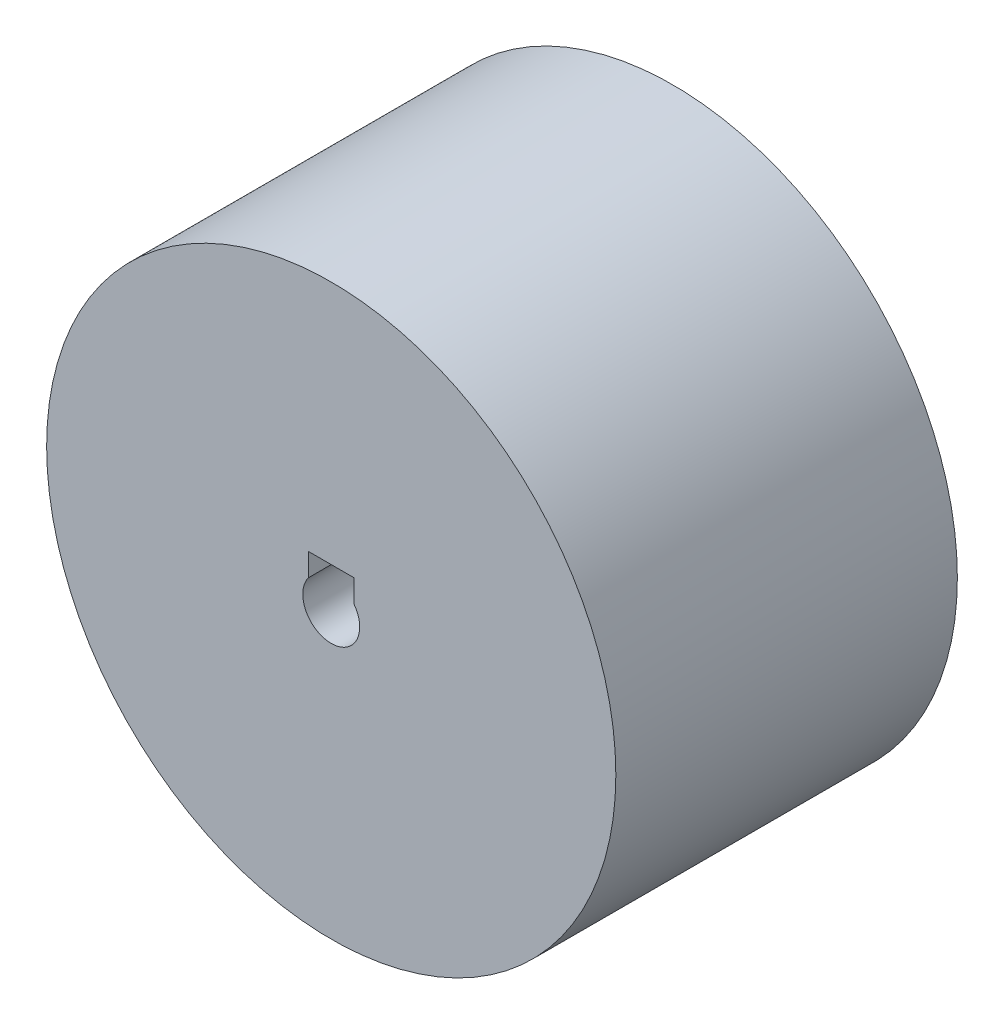
from build123d import *

# Parameters (mm, degrees)
ESQUISSE1_R             = 25
BOSS_EXTRU_1_DEPTH      = 30
ESQUISSE14_R            = 2.5
ENL_V_MAT_EXTRU_1_DEPTH = 47.368092477
ESQUISSE15_W            = 4
ESQUISSE15_H            = 2
ENL_V_MAT_EXTRU_2_DEPTH = 47.368092477


with BuildPart() as part:
    # Esquisse1 → Boss.-Extru.1 (new body)
    with BuildSketch(Plane.XY):
        Circle(ESQUISSE1_R)
    extrude(amount=BOSS_EXTRU_1_DEPTH)

    # Esquisse14 → Enlèv. mat.-Extru.1 (cut, through all)
    with BuildSketch(Plane(origin=(0, 0, 0), x_dir=(-1, 0, 0), z_dir=(0, 0, -1))):
        Circle(ESQUISSE14_R)
    extrude(amount=-ENL_V_MAT_EXTRU_1_DEPTH, mode=Mode.SUBTRACT)

    # Esquisse15 → Enlèv. mat.-Extru.2 (cut, through all)
    with BuildSketch(Plane(origin=(0, 0, 0), x_dir=(-1, 0, 0), z_dir=(0, 0, -1))):
        with Locations((0, 2.5)):
            Rectangle(ESQUISSE15_W, ESQUISSE15_H)
    extrude(amount=-ENL_V_MAT_EXTRU_2_DEPTH, mode=Mode.SUBTRACT)


solid = part.part
